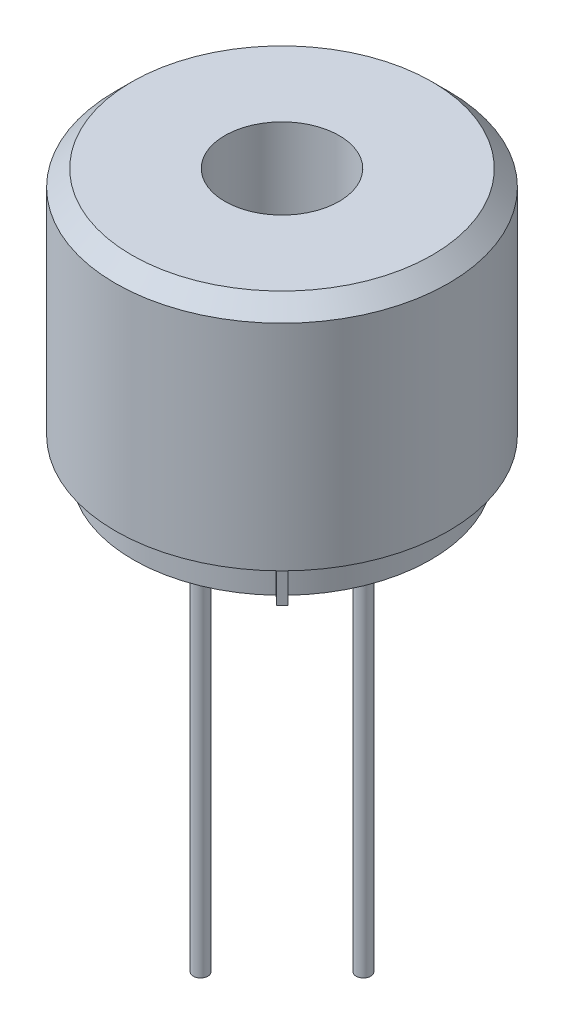
from build123d import *

# Parameters (mm, degrees)
SKETCH1_R           = 5.1
SKETCH1_R_2         = 4.6
SKETCH1_R_3         = 1.75
SKETCH1_R_4         = 0.75
BOSS_EXTRUDE1_DEPTH = 7.07
SKETCH1_5_R         = 0.75
CUT_EXTRUDE1_DEPTH  = 5.74
SKETCH1_6_R         = 1.75
SKETCH1_6_R_2       = 0.75
CUT_EXTRUDE2_DEPTH  = 4
CHAMFER1_SIZE       = 0.5
BOSS_EXTRUDE3_DEPTH = 1.03
BOSS_EXTRUDE4_DEPTH = 1.1
BOSS_EXTRUDE5_DEPTH = 13
BOSS_EXTRUDE6_START = -1.03
BOSS_EXTRUDE6_DEPTH = 1.03


with BuildPart() as part:
    # Sketch1 → Boss-Extrude1 (new body)
    # profile 1 of 4: a face of its own
    with BuildSketch(Plane(origin=(0, 0, 0), x_dir=(1, 0, 0), z_dir=(0, 1, 0))):
        with Locations(Location((0, 0, 0), (0, 0, 270))):
            Circle(SKETCH1_R)
        Circle(SKETCH1_R_2, mode=Mode.SUBTRACT)
    # profile 2 of 4: a face of its own
    with BuildSketch(Plane(origin=(0, 0, 0), x_dir=(1, 0, 0), z_dir=(0, 1, 0))):
        Circle(SKETCH1_R_2)
        Circle(SKETCH1_R_3, mode=Mode.SUBTRACT)
    # profile 3 of 4: a face of its own
    with BuildSketch(Plane(origin=(0, 0, 0), x_dir=(1, 0, 0), z_dir=(0, 1, 0))):
        Circle(SKETCH1_R_3)
        Circle(SKETCH1_R_4, mode=Mode.SUBTRACT)
    # profile 4 of 4: a face of its own
    with BuildSketch(Plane(origin=(0, 0, 0), x_dir=(1, 0, 0), z_dir=(0, 1, 0))):
        Circle(SKETCH1_R_4)
    extrude(amount=-BOSS_EXTRUDE1_DEPTH)

    # Sketch1<5> → Cut-Extrude1 (cut)
    with BuildSketch(Plane(origin=(0, 0, 0), x_dir=(1, 0, 0), z_dir=(0, 1, 0))):
        with Locations(Location((0, 0, 0), (0, 0, 270))):
            Circle(SKETCH1_5_R)
    extrude(amount=-CUT_EXTRUDE1_DEPTH, mode=Mode.SUBTRACT)

    # Sketch1<6> → Cut-Extrude2 (cut)
    with BuildSketch(Plane(origin=(0, 0, 0), x_dir=(1, 0, 0), z_dir=(0, 1, 0))):
        with Locations(Location((0, 0, 0), (0, 0, 270))):
            Circle(SKETCH1_6_R)
        with Locations(Location((0, 0, 0), (0, 0, 270))):
            Circle(SKETCH1_6_R_2, mode=Mode.SUBTRACT)
    extrude(amount=-CUT_EXTRUDE2_DEPTH, mode=Mode.SUBTRACT)

    # Chamfer1
    chamfer1_edges = [part.edges().sort_by_distance(p)[0] for p in [
        (0, 0, -5.1),
    ]]
    chamfer(chamfer1_edges, length=CHAMFER1_SIZE)

    # Sketch2 → Boss-Extrude3 (add)
    with BuildSketch(Plane.XZ.offset(7.07)):
        with BuildLine():
            ThreePointArc((-2.269632805, 0), (-2.494632805, 0.225), (-2.719632805, 0))
            Line((-2.719632805, 0), (-2.269632805, 0))
        make_face()
        with BuildLine():
            Line((-2.269632805, 0), (-2.719632805, 0))
            ThreePointArc((-2.719632805, 0), (-2.494632805, -0.225), (-2.269632805, 0))
        make_face()
        with BuildLine():
            ThreePointArc((-1.694632805, 0), (-2.494632805, 0.8), (-3.294632805, 0))
            Line((-3.294632805, 0), (-2.719632805, 0))
            ThreePointArc((-2.719632805, 0), (-2.494632805, 0.225), (-2.269632805, 0))
            Line((-2.269632805, 0), (-1.694632805, 0))
        make_face()
        with BuildLine():
            Line((-2.719632805, 0), (-3.294632805, 0))
            ThreePointArc((-3.294632805, 0), (-2.494632805, -0.8), (-1.694632805, 0))
            Line((-1.694632805, 0), (-2.269632805, 0))
            ThreePointArc((-2.269632805, 0), (-2.494632805, -0.225), (-2.719632805, 0))
        make_face()
        with BuildLine():
            ThreePointArc((0, -1.694632805), (-0.8, -2.494632805), (0, -3.294632805))
            Line((0, -3.294632805), (0, -2.719632805))
            ThreePointArc((0, -2.719632805), (-0.225, -2.494632805), (0, -2.269632805))
            Line((0, -2.269632805), (0, -1.694632805))
        make_face()
        with BuildLine():
            Line((0, -2.719632805), (0, -3.294632805))
            ThreePointArc((0, -3.294632805), (0.565685425, -3.06031823), (0.8, -2.494632805))
            ThreePointArc((0.8, -2.494632805), (0.565685425, -1.92894738), (0, -1.694632805))
            Line((0, -1.694632805), (0, -2.269632805))
            ThreePointArc((0, -2.269632805), (0.159099026, -2.335533779), (0.225, -2.494632805))
            ThreePointArc((0.225, -2.494632805), (0.159099026, -2.653731831), (0, -2.719632805))
        make_face()
        with BuildLine():
            ThreePointArc((0, -2.269632805), (-0.225, -2.494632805), (0, -2.719632805))
            Line((0, -2.719632805), (0, -2.269632805))
        make_face()
        with BuildLine():
            Line((0, -2.269632805), (0, -2.719632805))
            ThreePointArc((0, -2.719632805), (0.159099026, -2.653731831), (0.225, -2.494632805))
            ThreePointArc((0.225, -2.494632805), (0.159099026, -2.335533779), (0, -2.269632805))
        make_face()
        with BuildLine():
            ThreePointArc((0.225, 2.494632805), (0.159099026, 2.653731831), (0, 2.719632805))
            Line((0, 2.719632805), (0, 2.269632805))
            ThreePointArc((0, 2.269632805), (0.159099026, 2.335533779), (0.225, 2.494632805))
        make_face()
        with BuildLine():
            Line((0, 2.269632805), (0, 2.719632805))
            ThreePointArc((0, 2.719632805), (-0.225, 2.494632805), (0, 2.269632805))
        make_face()
        with BuildLine():
            ThreePointArc((0.8, 2.494632805), (0.565685425, 3.06031823), (0, 3.294632805))
            Line((0, 3.294632805), (0, 2.719632805))
            ThreePointArc((0, 2.719632805), (0.159099026, 2.653731831), (0.225, 2.494632805))
            ThreePointArc((0.225, 2.494632805), (0.159099026, 2.335533779), (0, 2.269632805))
            Line((0, 2.269632805), (0, 1.694632805))
            ThreePointArc((0, 1.694632805), (0.565685425, 1.92894738), (0.8, 2.494632805))
        make_face()
        with BuildLine():
            Line((0, 2.719632805), (0, 3.294632805))
            ThreePointArc((0, 3.294632805), (-0.8, 2.494632805), (0, 1.694632805))
            Line((0, 1.694632805), (0, 2.269632805))
            ThreePointArc((0, 2.269632805), (-0.225, 2.494632805), (0, 2.719632805))
        make_face()
        with BuildLine():
            ThreePointArc((2.269632805, 0), (2.494632805, -0.225), (2.719632805, 0))
            Line((2.719632805, 0), (2.269632805, 0))
        make_face()
        with BuildLine():
            Line((2.269632805, 0), (2.719632805, 0))
            ThreePointArc((2.719632805, 0), (2.494632805, 0.225), (2.269632805, 0))
        make_face()
        with BuildLine():
            ThreePointArc((1.694632805, 0), (2.494632805, -0.8), (3.294632805, 0))
            Line((3.294632805, 0), (2.719632805, 0))
            ThreePointArc((2.719632805, 0), (2.494632805, -0.225), (2.269632805, 0))
            Line((2.269632805, 0), (1.694632805, 0))
        make_face()
        with BuildLine():
            Line((2.719632805, 0), (3.294632805, 0))
            ThreePointArc((3.294632805, 0), (2.494632805, 0.8), (1.694632805, 0))
            Line((1.694632805, 0), (2.269632805, 0))
            ThreePointArc((2.269632805, 0), (2.494632805, 0.225), (2.719632805, 0))
        make_face()
        with BuildLine():
            Line((0, 3.294632805), (0, 4.56))
            ThreePointArc((0, 4.56), (-3.224406922, 3.224406922), (-4.56, 0))
            Line((-4.56, 0), (-3.294632805, 0))
            ThreePointArc((-3.294632805, 0), (-2.494632805, 0.8), (-1.694632805, 0))
            Line((-1.694632805, 0), (0, 0))
            Line((0, 0), (0, 1.694632805))
            ThreePointArc((0, 1.694632805), (-0.8, 2.494632805), (0, 3.294632805))
        make_face()
        with BuildLine():
            Line((-3.294632805, 0), (-4.56, 0))
            ThreePointArc((-4.56, 0), (-3.224406922, -3.224406922), (0, -4.56))
            Line((0, -4.56), (0, -3.294632805))
            ThreePointArc((0, -3.294632805), (-0.8, -2.494632805), (0, -1.694632805))
            Line((0, -1.694632805), (0, 0))
            Line((0, 0), (-1.694632805, 0))
            ThreePointArc((-1.694632805, 0), (-2.494632805, -0.8), (-3.294632805, 0))
        make_face()
        with BuildLine():
            ThreePointArc((0, -4.56), (3.224406922, -3.224406922), (4.56, 0))
            Line((4.56, 0), (3.294632805, 0))
            ThreePointArc((3.294632805, 0), (2.494632805, -0.8), (1.694632805, 0))
            Line((1.694632805, 0), (0, 0))
            Line((0, 0), (0, -1.694632805))
            ThreePointArc((0, -1.694632805), (0.565685425, -1.92894738), (0.8, -2.494632805))
            ThreePointArc((0.8, -2.494632805), (0.565685425, -3.06031823), (0, -3.294632805))
            Line((0, -3.294632805), (0, -4.56))
        make_face()
        with BuildLine():
            ThreePointArc((3.201624221, 3.247029773), (1.730194243, 4.219007926), (0, 4.56))
            Line((0, 4.56), (0, 3.294632805))
            ThreePointArc((0, 3.294632805), (0.565685425, 3.06031823), (0.8, 2.494632805))
            ThreePointArc((0.8, 2.494632805), (0.565685425, 1.92894738), (0, 1.694632805))
            Line((0, 1.694632805), (0, 0))
            Line((0, 0), (1.694632805, 0))
            ThreePointArc((1.694632805, 0), (2.494632805, 0.8), (3.294632805, 0))
            Line((3.294632805, 0), (4.56, 0))
            ThreePointArc((4.56, 0), (4.206721196, 1.759857033), (3.201624221, 3.247029773))
        make_face()
    extrude(amount=BOSS_EXTRUDE3_DEPTH)

    # Sketch2<3> → Boss-Extrude4 (add)
    with BuildSketch(Plane.XZ.offset(7.07)):
        with BuildLine():
            ThreePointArc((-1.694632805, 0), (-2.494632805, 0.8), (-3.294632805, 0))
            Line((-3.294632805, 0), (-2.719632805, 0))
            ThreePointArc((-2.719632805, 0), (-2.494632805, 0.225), (-2.269632805, 0))
            Line((-2.269632805, 0), (-1.694632805, 0))
        make_face()
        with BuildLine():
            Line((-2.719632805, 0), (-3.294632805, 0))
            ThreePointArc((-3.294632805, 0), (-2.494632805, -0.8), (-1.694632805, 0))
            Line((-1.694632805, 0), (-2.269632805, 0))
            ThreePointArc((-2.269632805, 0), (-2.494632805, -0.225), (-2.719632805, 0))
        make_face()
        with BuildLine():
            ThreePointArc((-2.269632805, 0), (-2.494632805, 0.225), (-2.719632805, 0))
            Line((-2.719632805, 0), (-2.269632805, 0))
        make_face()
        with BuildLine():
            Line((-2.269632805, 0), (-2.719632805, 0))
            ThreePointArc((-2.719632805, 0), (-2.494632805, -0.225), (-2.269632805, 0))
        make_face()
        with BuildLine():
            ThreePointArc((0, -2.269632805), (-0.225, -2.494632805), (0, -2.719632805))
            Line((0, -2.719632805), (0, -2.269632805))
        make_face()
        with BuildLine():
            Line((0, -2.269632805), (0, -2.719632805))
            ThreePointArc((0, -2.719632805), (0.159099026, -2.653731831), (0.225, -2.494632805))
            ThreePointArc((0.225, -2.494632805), (0.159099026, -2.335533779), (0, -2.269632805))
        make_face()
        with BuildLine():
            ThreePointArc((0, -1.694632805), (-0.8, -2.494632805), (0, -3.294632805))
            Line((0, -3.294632805), (0, -2.719632805))
            ThreePointArc((0, -2.719632805), (-0.225, -2.494632805), (0, -2.269632805))
            Line((0, -2.269632805), (0, -1.694632805))
        make_face()
        with BuildLine():
            Line((0, -2.719632805), (0, -3.294632805))
            ThreePointArc((0, -3.294632805), (0.565685425, -3.06031823), (0.8, -2.494632805))
            ThreePointArc((0.8, -2.494632805), (0.565685425, -1.92894738), (0, -1.694632805))
            Line((0, -1.694632805), (0, -2.269632805))
            ThreePointArc((0, -2.269632805), (0.159099026, -2.335533779), (0.225, -2.494632805))
            ThreePointArc((0.225, -2.494632805), (0.159099026, -2.653731831), (0, -2.719632805))
        make_face()
        with BuildLine():
            ThreePointArc((2.269632805, 0), (2.494632805, -0.225), (2.719632805, 0))
            Line((2.719632805, 0), (2.269632805, 0))
        make_face()
        with BuildLine():
            Line((2.269632805, 0), (2.719632805, 0))
            ThreePointArc((2.719632805, 0), (2.494632805, 0.225), (2.269632805, 0))
        make_face()
        with BuildLine():
            ThreePointArc((1.694632805, 0), (2.494632805, -0.8), (3.294632805, 0))
            Line((3.294632805, 0), (2.719632805, 0))
            ThreePointArc((2.719632805, 0), (2.494632805, -0.225), (2.269632805, 0))
            Line((2.269632805, 0), (1.694632805, 0))
        make_face()
        with BuildLine():
            Line((2.719632805, 0), (3.294632805, 0))
            ThreePointArc((3.294632805, 0), (2.494632805, 0.8), (1.694632805, 0))
            Line((1.694632805, 0), (2.269632805, 0))
            ThreePointArc((2.269632805, 0), (2.494632805, 0.225), (2.719632805, 0))
        make_face()
        with BuildLine():
            ThreePointArc((0.225, 2.494632805), (0.159099026, 2.653731831), (0, 2.719632805))
            Line((0, 2.719632805), (0, 2.269632805))
            ThreePointArc((0, 2.269632805), (0.159099026, 2.335533779), (0.225, 2.494632805))
        make_face()
        with BuildLine():
            Line((0, 2.269632805), (0, 2.719632805))
            ThreePointArc((0, 2.719632805), (-0.225, 2.494632805), (0, 2.269632805))
        make_face()
        with BuildLine():
            ThreePointArc((0.8, 2.494632805), (0.565685425, 3.06031823), (0, 3.294632805))
            Line((0, 3.294632805), (0, 2.719632805))
            ThreePointArc((0, 2.719632805), (0.159099026, 2.653731831), (0.225, 2.494632805))
            ThreePointArc((0.225, 2.494632805), (0.159099026, 2.335533779), (0, 2.269632805))
            Line((0, 2.269632805), (0, 1.694632805))
            ThreePointArc((0, 1.694632805), (0.565685425, 1.92894738), (0.8, 2.494632805))
        make_face()
        with BuildLine():
            Line((0, 2.719632805), (0, 3.294632805))
            ThreePointArc((0, 3.294632805), (-0.8, 2.494632805), (0, 1.694632805))
            Line((0, 1.694632805), (0, 2.269632805))
            ThreePointArc((0, 2.269632805), (-0.225, 2.494632805), (0, 2.719632805))
        make_face()
    extrude(amount=BOSS_EXTRUDE4_DEPTH)

    # Sketch2<4> → Boss-Extrude5 (add)
    with BuildSketch(Plane.XZ.offset(7.07)):
        with BuildLine():
            ThreePointArc((-2.269632805, 0), (-2.494632805, 0.225), (-2.719632805, 0))
            Line((-2.719632805, 0), (-2.269632805, 0))
        make_face()
        with BuildLine():
            Line((-2.269632805, 0), (-2.719632805, 0))
            ThreePointArc((-2.719632805, 0), (-2.494632805, -0.225), (-2.269632805, 0))
        make_face()
        with BuildLine():
            ThreePointArc((0.225, 2.494632805), (0.159099026, 2.653731831), (0, 2.719632805))
            Line((0, 2.719632805), (0, 2.269632805))
            ThreePointArc((0, 2.269632805), (0.159099026, 2.335533779), (0.225, 2.494632805))
        make_face()
        with BuildLine():
            Line((0, 2.269632805), (0, 2.719632805))
            ThreePointArc((0, 2.719632805), (-0.225, 2.494632805), (0, 2.269632805))
        make_face()
        with BuildLine():
            ThreePointArc((2.269632805, 0), (2.494632805, -0.225), (2.719632805, 0))
            Line((2.719632805, 0), (2.269632805, 0))
        make_face()
        with BuildLine():
            Line((2.269632805, 0), (2.719632805, 0))
            ThreePointArc((2.719632805, 0), (2.494632805, 0.225), (2.269632805, 0))
        make_face()
        with BuildLine():
            ThreePointArc((0, -2.269632805), (-0.225, -2.494632805), (0, -2.719632805))
            Line((0, -2.719632805), (0, -2.269632805))
        make_face()
        with BuildLine():
            Line((0, -2.269632805), (0, -2.719632805))
            ThreePointArc((0, -2.719632805), (0.159099026, -2.653731831), (0.225, -2.494632805))
            ThreePointArc((0.225, -2.494632805), (0.159099026, -2.335533779), (0, -2.269632805))
        make_face()
    extrude(amount=BOSS_EXTRUDE5_DEPTH)

    # Sketch4 → Boss-Extrude6 (add)
    with BuildSketch(Plane.XZ.offset(8.1).offset(BOSS_EXTRUDE6_START)):
        with BuildLine():
            Line((3.412284181, 3.579752451), (3.134148267, 3.312206914))
            ThreePointArc((3.134148267, 3.312206914), (3.179580669, 3.26861848), (3.224406922, 3.224406922))
            ThreePointArc((3.224406922, 3.224406922), (3.268594957, 3.179604851), (3.31216054, 3.134197275))
            Line((3.31216054, 3.134197275), (3.58677462, 3.398355077))
            Line((3.58677462, 3.398355077), (3.412284181, 3.579752451))
        make_face()
    extrude(amount=BOSS_EXTRUDE6_DEPTH)


solid = part.part
